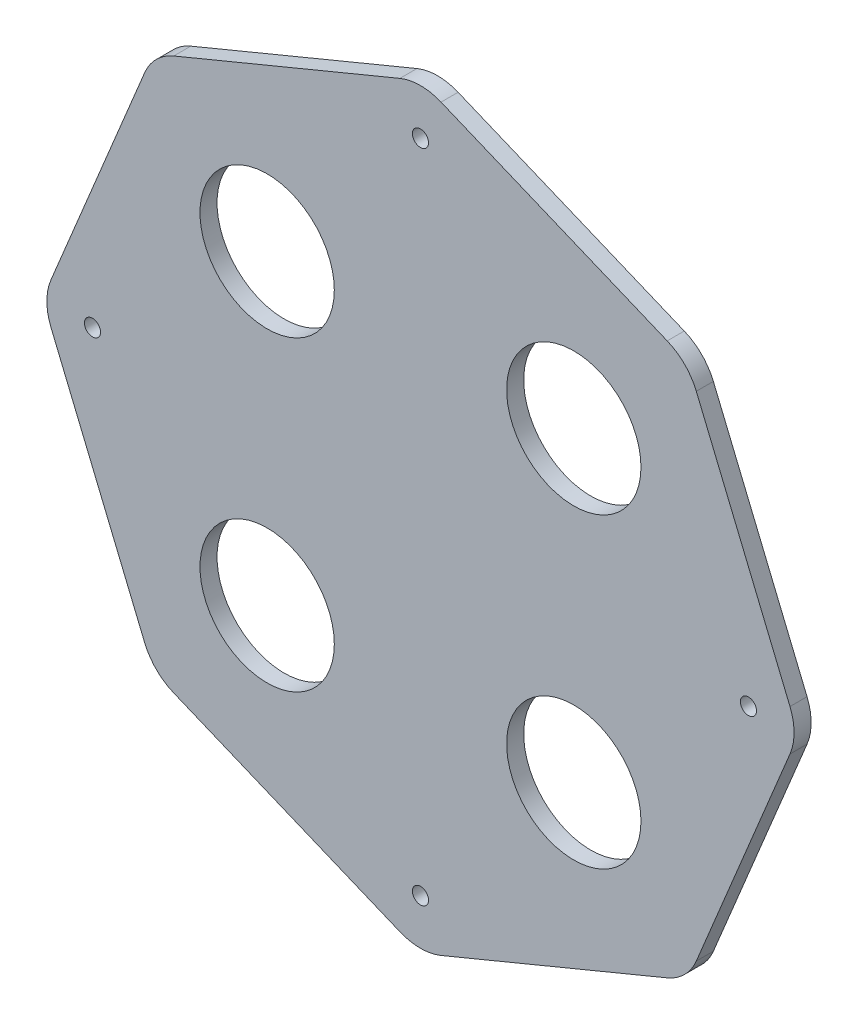
from build123d import *

# Parameters (mm, degrees)
SKETCH1_R           = 1.5
SKETCH1_R_2         = 12.5
BOSS_EXTRUDE1_DEPTH = 3.175
FILLET1_R           = 10
FILLET2_R           = 10


with BuildPart() as part:
    # Sketch1 → Boss-Extrude1 (new body)
    with BuildSketch(Plane.XY):
        Polygon((70.355493019, 0), (49.748846207, 49.748846207), (0, 70.355493019), (-49.748846207, 49.748846207), (-70.355493019, 0), (-49.748846207, -49.748846207), (0, -70.355493019), (49.748846207, -49.748846207), align=None)
        with Locations((0, 61.04)):
            Circle(SKETCH1_R, mode=Mode.SUBTRACT)
        with Locations((61.04, 0)):
            Circle(SKETCH1_R, mode=Mode.SUBTRACT)
        with Locations((0, -61.04)):
            Circle(SKETCH1_R, mode=Mode.SUBTRACT)
        with Locations((-61.04, 0)):
            Circle(SKETCH1_R, mode=Mode.SUBTRACT)
        with Locations((-28.535642772, 28.535642772)):
            Circle(SKETCH1_R_2, mode=Mode.SUBTRACT)
        with Locations((28.535642772, 28.535642772)):
            Circle(SKETCH1_R_2, mode=Mode.SUBTRACT)
        with Locations((-28.535642772, -28.535642772)):
            Circle(SKETCH1_R_2, mode=Mode.SUBTRACT)
        with Locations((28.535642772, -28.535642772)):
            Circle(SKETCH1_R_2, mode=Mode.SUBTRACT)
    extrude(amount=BOSS_EXTRUDE1_DEPTH)

    # Fillet1
    fillet1_edges = [part.edges().sort_by_distance(p)[0] for p in [
        (49.748846207, -49.748846207, 1.5875),
        (0, -70.355493019, 1.5875),
        (-49.748846207, -49.748846207, 1.5875),
        (-70.355493019, 0, 1.5875),
        (0, 70.355493019, 1.5875),
        (49.748846207, 49.748846207, 1.5875),
        (70.355493019, 0, 1.5875),
    ]]
    fillet(fillet1_edges, radius=FILLET1_R)

    # Fillet2
    fillet2_edges = [part.edges().sort_by_distance(p)[0] for p in [
        (-49.748846207, 49.748846207, 1.5875),
    ]]
    fillet(fillet2_edges, radius=FILLET2_R)


solid = part.part
